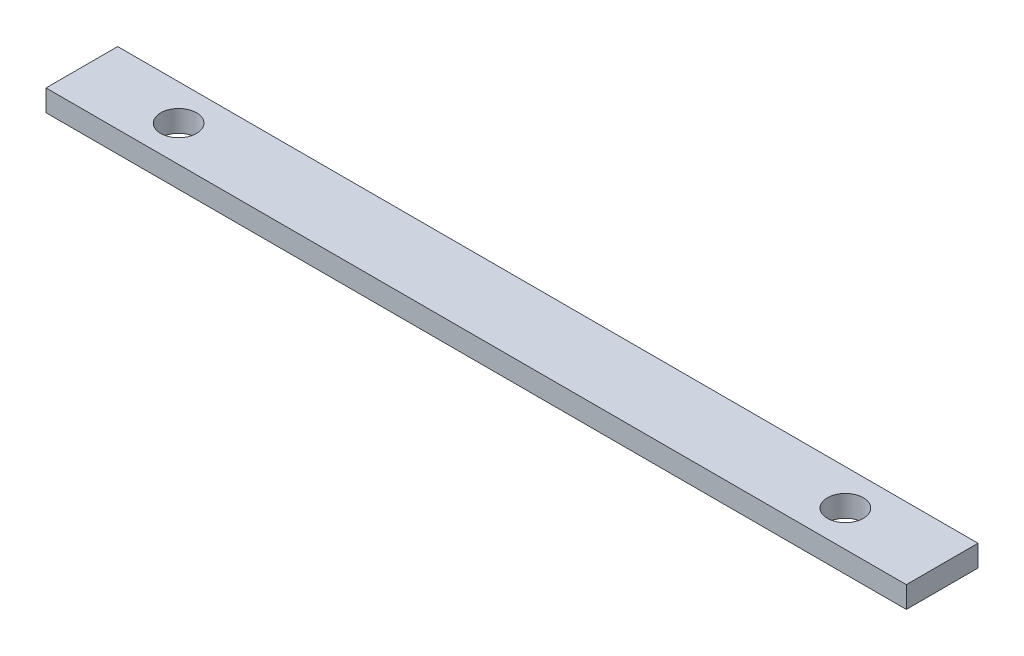
from build123d import *

# Parameters (mm, degrees)
SKETCH3_W           = 120
SKETCH3_H           = 10
BOSS_EXTRUDE1_DEPTH = 3
SKETCH5_R           = 2.5
CUT_EXTRUDE1_DEPTH  = 3


with BuildPart() as part:
    # Sketch3 → Boss-Extrude1 (new body)
    with BuildSketch(Plane(origin=(0, 0, 0), x_dir=(1, 0, 0), z_dir=(0, 1, 0))):
        Rectangle(SKETCH3_W, SKETCH3_H)
    extrude(amount=BOSS_EXTRUDE1_DEPTH)

    # Sketch5 → Cut-Extrude1 (cut)
    with BuildSketch(Plane(origin=(0, 0, 0), x_dir=(1, 0, 0), z_dir=(0, 1, 0))):
        with Locations(Location((-46.5, 0, 0), (0, 0, 90))):
            Circle(SKETCH5_R)
        with Locations(Location((46.5, 0, 0), (0, 0, 90))):
            Circle(SKETCH5_R)
    extrude(amount=CUT_EXTRUDE1_DEPTH, mode=Mode.SUBTRACT)


solid = part.part
